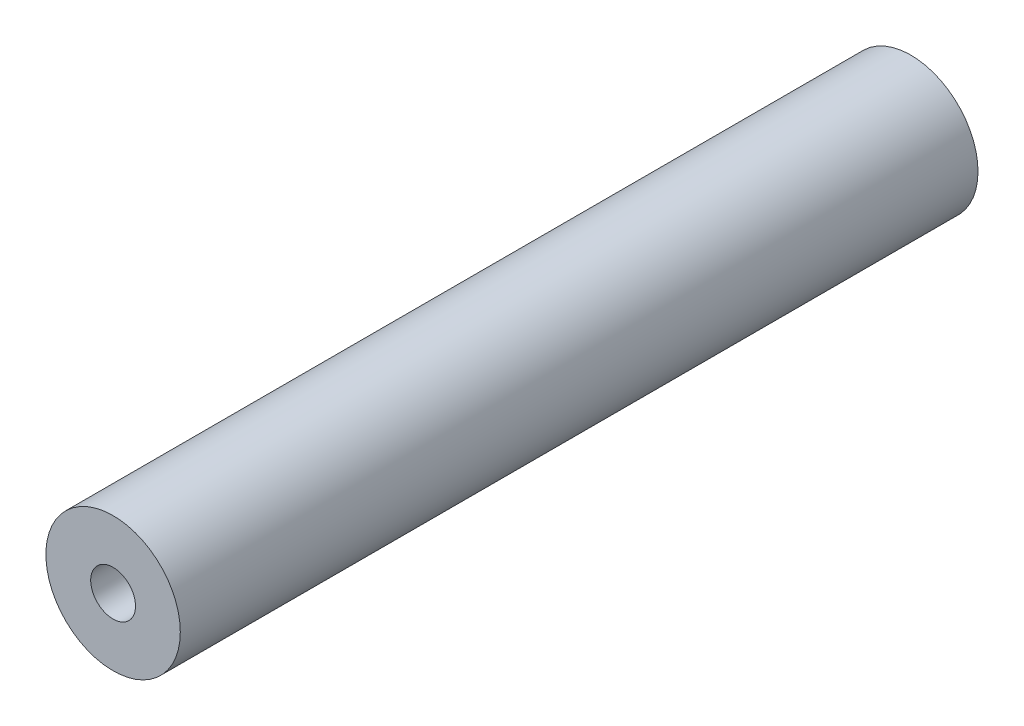
from build123d import *

# Parameters (mm, degrees)
CROQUIS1_R              = 7.5
SALIENTE_EXTRUIR1_DEPTH = 89
CROQUIS2_R              = 2.5
CORTAR_EXTRUIR1_DEPTH   = 89


with BuildPart() as part:
    # Croquis1 → Saliente-Extruir1 (new body)
    with BuildSketch(Plane.XY):
        Circle(CROQUIS1_R)
    extrude(amount=-SALIENTE_EXTRUIR1_DEPTH)

    # Croquis2 → Cortar-Extruir1 (cut)
    with BuildSketch(Plane.XY):
        Circle(CROQUIS2_R)
    extrude(amount=-CORTAR_EXTRUIR1_DEPTH, mode=Mode.SUBTRACT)


solid = part.part
